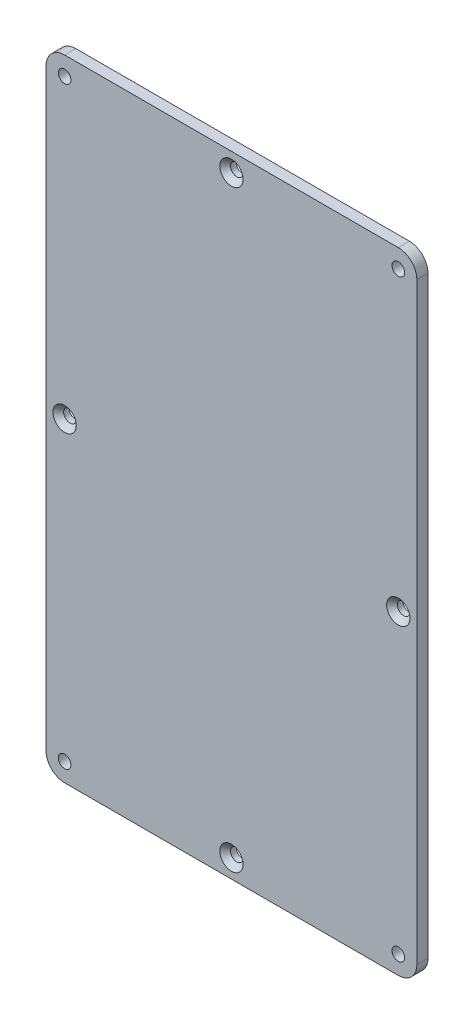
from build123d import *

# Parameters (mm, degrees)
SKETCH1_W                                       = 100
SKETCH1_H                                       = 170
BOSS_EXTRUDE1_DEPTH                             = 3
M3_CLEARANCE_HOLE1_D                            = 3.4
M3_CLEARANCE_HOLE1_DEPTH                        = 7.5
M3_CLEARANCE_HOLE1_TIP                          = 1.021463052
FILLET1_R                                       = 5
CSK_FOR_M3_FLAT_HEAD_MACHINE_SCREW1_D           = 3.4
CSK_FOR_M3_FLAT_HEAD_MACHINE_SCREW1_DEPTH       = 7.5
CSK_FOR_M3_FLAT_HEAD_MACHINE_SCREW1_CSINK_D     = 6.3
CSK_FOR_M3_FLAT_HEAD_MACHINE_SCREW1_CSINK_ANGLE = 90
CSK_FOR_M3_FLAT_HEAD_MACHINE_SCREW1_TIP         = 1.021463052


with BuildPart() as part:
    # Sketch1 → Boss-Extrude1 (new body)
    with BuildSketch(Plane.XY):
        with Locations((50, 85)):
            Rectangle(SKETCH1_W, SKETCH1_H)
    extrude(amount=BOSS_EXTRUDE1_DEPTH)

    # M3 Clearance Hole1
    with Locations(Plane.XY.offset(3)):
        with Locations((5, 165), (95, 165), (95, 5), (5, 5)):
            Hole(M3_CLEARANCE_HOLE1_D / 2, depth=M3_CLEARANCE_HOLE1_DEPTH)
            with Locations((0, 0, -(M3_CLEARANCE_HOLE1_DEPTH + M3_CLEARANCE_HOLE1_TIP / 2))):  # 118° drill point
                Cone(0, M3_CLEARANCE_HOLE1_D / 2, M3_CLEARANCE_HOLE1_TIP, mode=Mode.SUBTRACT)

    # Fillet1
    fillet1_edges = [part.edges().sort_by_distance(p)[0] for p in [
        (0, 170, 1.5),
        (100, 170, 1.5),
        (100, 0, 1.5),
        (0, 0, 1.5),
    ]]
    fillet(fillet1_edges, radius=FILLET1_R)

    # CSK for M3 Flat Head Machine Screw1
    with Locations(Plane.XY.offset(3)):
        with Locations((50, 165), (50, 5), (95, 85), (5, 85)):
            CounterSinkHole(CSK_FOR_M3_FLAT_HEAD_MACHINE_SCREW1_D / 2, CSK_FOR_M3_FLAT_HEAD_MACHINE_SCREW1_CSINK_D / 2, depth=CSK_FOR_M3_FLAT_HEAD_MACHINE_SCREW1_DEPTH, counter_sink_angle=CSK_FOR_M3_FLAT_HEAD_MACHINE_SCREW1_CSINK_ANGLE)
            with Locations((0, 0, -(CSK_FOR_M3_FLAT_HEAD_MACHINE_SCREW1_DEPTH + CSK_FOR_M3_FLAT_HEAD_MACHINE_SCREW1_TIP / 2))):  # 118° drill point
                Cone(0, CSK_FOR_M3_FLAT_HEAD_MACHINE_SCREW1_D / 2, CSK_FOR_M3_FLAT_HEAD_MACHINE_SCREW1_TIP, mode=Mode.SUBTRACT)


solid = part.part
